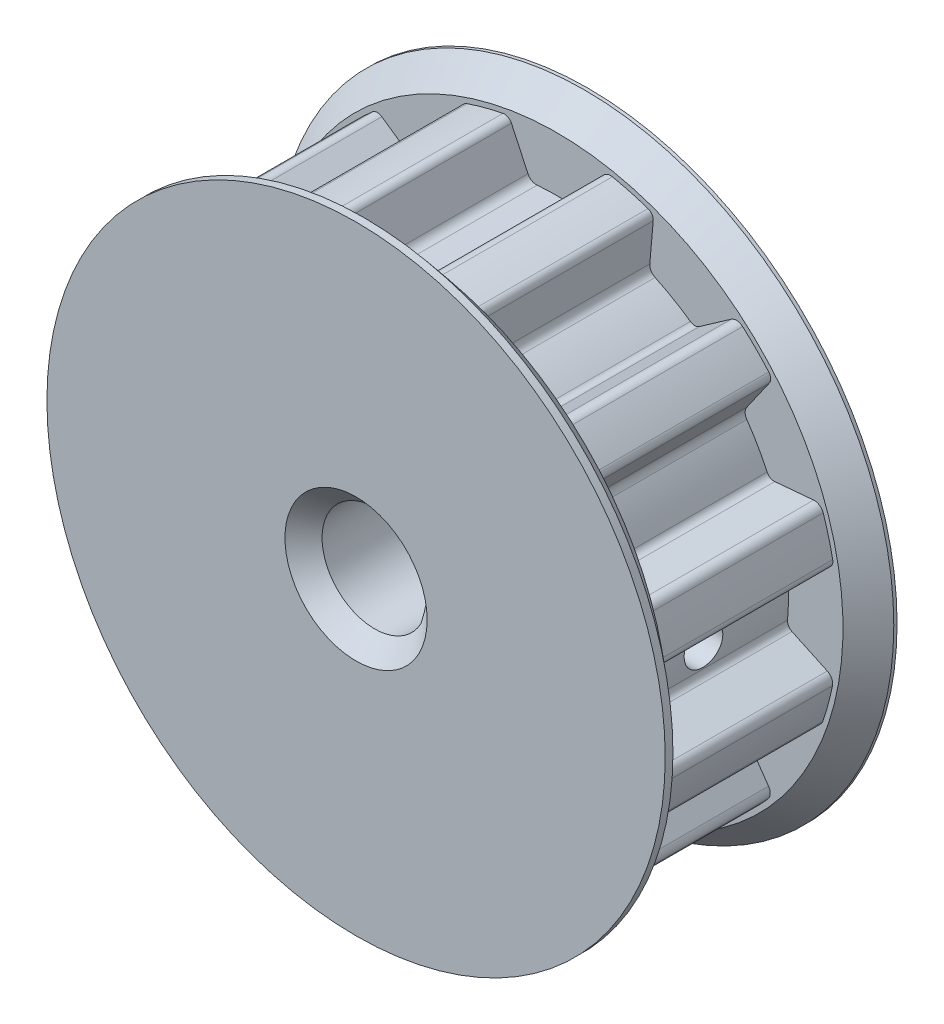
from build123d import *

# Parameters (mm, degrees)
EXTRUDE_1_DEPTH             = 5.5
SKETCH_2_R                  = 20
EXTRUDE_2_DEPTH             = 2
CHAMFER_1_SIZE              = 1.5
CHAMFER_1_SIZE2             = 1.787630389
CHAMFER_1_OF_MIRROR_1_SIZE2 = 1.5
CHAMFER_1_OF_MIRROR_1_SIZE  = 1.787630389
SKETCH_3_R                  = 3.4
CUT_EXTRUDE_1_DEPTH         = 30
CHAMFER_2_SIZE              = 1.2
EXTRUDE_3_REACH             = 31.262
EXTRUDE_3_DIRECTION_2_REACH = 31.262
SKETCH_6_R                  = 1.25
CUT_EXTRUDE_3_DEPTH         = 33
SKETCH_5_R                  = 1.25
CUT_EXTRUDE_2_DEPTH         = 20


with BuildPart() as part:
    # 스케치1 → 보스-돌출1 (new, symmetric)
    with BuildSketch(Plane.XY):
        with BuildLine():
            Line((12.279067203, 9.260056493), (13.72951471, 11.331510209))
            ThreePointArc((13.72951471, 11.331510209), (13.819231237, 11.644886966), (13.696740348, 11.946963163))
            ThreePointArc((13.696740348, 11.946963163), (12.880233507, 12.823034344), (12.007805037, 13.643432236))
            ThreePointArc((12.007805037, 13.643432236), (11.644638313, 13.792108644), (11.267252957, 13.684521298))
            Line((11.267252957, 13.684521298), (9.202645163, 12.238867358))
            ThreePointArc((9.202645163, 12.238867358), (8.915071795, 12.148443996), (8.627783828, 12.239770064))
            ThreePointArc((8.627783828, 12.239770064), (7.516754209, 12.951796446), (6.347354905, 13.563248531))
            ThreePointArc((6.347354905, 13.563248531), (6.081851507, 13.807041329), (6.003955886, 14.158977765))
            Line((6.003955886, 14.158977765), (6.224353416, 16.678133059))
            ThreePointArc((6.224353416, 16.678133059), (6.145361829, 16.994383555), (5.888243509, 17.194743772))
            ThreePointArc((5.888243509, 17.194743772), (4.743092252, 17.54519025), (3.577348088, 17.81946143))
            ThreePointArc((3.577348088, 17.81946143), (3.188498275, 17.766635614), (2.915466643, 17.484769561))
            Line((2.915466643, 17.484769561), (1.850290815, 15.200492627))
            ThreePointArc((1.850290815, 15.200492627), (1.646456756, 14.978397074), (1.351995179, 14.913843704))
            ThreePointArc((1.351995179, 14.913843704), (0.033801995, 14.974961851), (-1.284653671, 14.919795238))
            ThreePointArc((-1.284653671, 14.919795238), (-1.636482757, 14.998174295), (-1.879910562, 15.26401238))
            Line((-1.879910562, 15.26401238), (-2.948618349, 17.555863625))
            ThreePointArc((-2.948618349, 17.555863625), (-3.175152318, 17.790248795), (-3.498003423, 17.835206672))
            ThreePointArc((-3.498003423, 17.835206672), (-4.664956742, 17.566126596), (-5.811656393, 17.220780324))
            ThreePointArc((-5.811656393, 17.220780324), (-6.121997301, 16.980606919), (-6.217516604, 16.599987941))
            Line((-6.217516604, 16.599987941), (-5.997847464, 14.089158172))
            ThreePointArc((-5.997847464, 14.089158172), (-6.06332522, 13.794900649), (-6.286059898, 13.591765005))
            ThreePointArc((-6.286059898, 13.591765005), (-7.458207642, 12.985598321), (-8.572440333, 12.27859486))
            ThreePointArc((-8.572440333, 12.27859486), (-8.916322788, 12.170558572), (-9.260056493, 12.279067203))
            Line((-9.260056493, 12.279067203), (-11.331510209, 13.72951471))
            ThreePointArc((-11.331510209, 13.72951471), (-11.644886966, 13.819231237), (-11.946963163, 13.696740348))
            ThreePointArc((-11.946963163, 13.696740348), (-12.823034344, 12.880233507), (-13.643432236, 12.007805037))
            ThreePointArc((-13.643432236, 12.007805037), (-13.792108644, 11.644638313), (-13.684521298, 11.267252957))
            Line((-13.684521298, 11.267252957), (-12.238867358, 9.202645163))
            ThreePointArc((-12.238867358, 9.202645163), (-12.148443996, 8.915071795), (-12.239770064, 8.627783828))
            ThreePointArc((-12.239770064, 8.627783828), (-12.951796446, 7.516754209), (-13.563248531, 6.347354905))
            ThreePointArc((-13.563248531, 6.347354905), (-13.807041329, 6.081851507), (-14.158977765, 6.003955886))
            Line((-14.158977765, 6.003955886), (-16.678133059, 6.224353416))
            ThreePointArc((-16.678133059, 6.224353416), (-16.994383555, 6.145361829), (-17.194743772, 5.888243509))
            ThreePointArc((-17.194743772, 5.888243509), (-17.54519025, 4.743092252), (-17.81946143, 3.577348088))
            ThreePointArc((-17.81946143, 3.577348088), (-17.766635614, 3.188498275), (-17.484769561, 2.915466643))
            Line((-17.484769561, 2.915466643), (-15.200492627, 1.850290815))
            ThreePointArc((-15.200492627, 1.850290815), (-14.978397015, 1.646456653), (-14.913843726, 1.351994942))
            ThreePointArc((-14.913843726, 1.351994942), (-14.974961851, 0.033801876), (-14.919795238, -1.284653671))
            ThreePointArc((-14.919795238, -1.284653671), (-14.998174295, -1.636482757), (-15.26401238, -1.879910562))
            Line((-15.26401238, -1.879910562), (-17.555863625, -2.948618349))
            ThreePointArc((-17.555863625, -2.948618349), (-17.790248795, -3.175152318), (-17.835206672, -3.498003423))
            ThreePointArc((-17.835206672, -3.498003423), (-17.566126596, -4.664956742), (-17.220780324, -5.811656393))
            ThreePointArc((-17.220780324, -5.811656393), (-16.980606919, -6.121997301), (-16.599987941, -6.217516604))
            Line((-16.599987941, -6.217516604), (-14.089158172, -5.997847464))
            ThreePointArc((-14.089158172, -5.997847464), (-13.794900649, -6.06332522), (-13.591765005, -6.286059898))
            ThreePointArc((-13.591765005, -6.286059898), (-12.985598321, -7.458207642), (-12.27859486, -8.572440333))
            ThreePointArc((-12.27859486, -8.572440333), (-12.170558572, -8.916322788), (-12.279067203, -9.260056493))
            Line((-12.279067203, -9.260056493), (-13.72951471, -11.331510209))
            ThreePointArc((-13.72951471, -11.331510209), (-13.819231237, -11.644886966), (-13.696740348, -11.946963163))
            ThreePointArc((-13.696740348, -11.946963163), (-12.880233507, -12.823034344), (-12.007805037, -13.643432236))
            ThreePointArc((-12.007805037, -13.643432236), (-11.644638313, -13.792108644), (-11.267252957, -13.684521298))
            Line((-11.267252957, -13.684521298), (-9.202645163, -12.238867358))
            ThreePointArc((-9.202645163, -12.238867358), (-8.915071795, -12.148443996), (-8.627783828, -12.239770064))
            ThreePointArc((-8.627783828, -12.239770064), (-7.516754209, -12.951796446), (-6.347354905, -13.563248531))
            ThreePointArc((-6.347354905, -13.563248531), (-6.081851507, -13.807041329), (-6.003955886, -14.158977765))
            Line((-6.003955886, -14.158977765), (-6.224353416, -16.678133059))
            ThreePointArc((-6.224353416, -16.678133059), (-6.145361829, -16.994383555), (-5.888243509, -17.194743772))
            ThreePointArc((-5.888243509, -17.194743772), (-4.743092252, -17.54519025), (-3.577348088, -17.81946143))
            ThreePointArc((-3.577348088, -17.81946143), (-3.188498275, -17.766635614), (-2.915466643, -17.484769561))
            Line((-2.915466643, -17.484769561), (-1.850290815, -15.200492627))
            ThreePointArc((-1.850290815, -15.200492627), (-1.646456653, -14.978397015), (-1.351994942, -14.913843726))
            ThreePointArc((-1.351994942, -14.913843726), (-0.033801876, -14.974961851), (1.284653671, -14.919795238))
            ThreePointArc((1.284653671, -14.919795238), (1.636482757, -14.998174295), (1.879910562, -15.26401238))
            Line((1.879910562, -15.26401238), (2.948618349, -17.555863625))
            ThreePointArc((2.948618349, -17.555863625), (3.175152318, -17.790248795), (3.498003423, -17.835206672))
            ThreePointArc((3.498003423, -17.835206672), (4.664956742, -17.566126596), (5.811656393, -17.220780324))
            ThreePointArc((5.811656393, -17.220780324), (6.121997301, -16.980606919), (6.217516604, -16.599987941))
            Line((6.217516604, -16.599987941), (5.997847464, -14.089158172))
            ThreePointArc((5.997847464, -14.089158172), (6.06332522, -13.794900649), (6.286059898, -13.591765005))
            ThreePointArc((6.286059898, -13.591765005), (7.458207642, -12.985598321), (8.572440333, -12.27859486))
            ThreePointArc((8.572440333, -12.27859486), (8.916322788, -12.170558572), (9.260056493, -12.279067203))
            Line((9.260056493, -12.279067203), (11.331510209, -13.72951471))
            ThreePointArc((11.331510209, -13.72951471), (11.644886966, -13.819231237), (11.946963163, -13.696740348))
            ThreePointArc((11.946963163, -13.696740348), (12.823034344, -12.880233507), (13.643432236, -12.007805037))
            ThreePointArc((13.643432236, -12.007805037), (13.792108644, -11.644638313), (13.684521298, -11.267252957))
            Line((13.684521298, -11.267252957), (12.238867358, -9.202645163))
            ThreePointArc((12.238867358, -9.202645163), (12.148443996, -8.915071914), (12.239769926, -8.627784023))
            ThreePointArc((12.239769926, -8.627784023), (12.951796386, -7.516754312), (13.563248531, -6.347354905))
            ThreePointArc((13.563248531, -6.347354905), (13.807041329, -6.081851507), (14.158977765, -6.003955886))
            Line((14.158977765, -6.003955886), (16.678133059, -6.224353416))
            ThreePointArc((16.678133059, -6.224353416), (16.994383555, -6.145361829), (17.194743772, -5.888243509))
            ThreePointArc((17.194743772, -5.888243509), (17.54519025, -4.743092252), (17.81946143, -3.577348088))
            ThreePointArc((17.81946143, -3.577348088), (17.766635614, -3.188498275), (17.484769561, -2.915466643))
            Line((17.484769561, -2.915466643), (15.200492627, -1.850290815))
            ThreePointArc((15.200492627, -1.850290815), (14.978397015, -1.646456653), (14.913843726, -1.351994942))
            ThreePointArc((14.913843726, -1.351994942), (14.974961851, -0.033801876), (14.919795238, 1.284653671))
            ThreePointArc((14.919795238, 1.284653671), (14.998174295, 1.636482757), (15.26401238, 1.879910562))
            Line((15.26401238, 1.879910562), (17.555863625, 2.948618349))
            ThreePointArc((17.555863625, 2.948618349), (17.790248795, 3.175152318), (17.835206672, 3.498003423))
            ThreePointArc((17.835206672, 3.498003423), (17.566126596, 4.664956742), (17.220780324, 5.811656393))
            ThreePointArc((17.220780324, 5.811656393), (16.980606919, 6.121997301), (16.599987941, 6.217516604))
            Line((16.599987941, 6.217516604), (14.089158172, 5.997847464))
            ThreePointArc((14.089158172, 5.997847464), (13.794900649, 6.06332522), (13.591765005, 6.286059898))
            ThreePointArc((13.591765005, 6.286059898), (12.985598253, 7.458207762), (12.278594702, 8.572440559))
            ThreePointArc((12.278594702, 8.572440559), (12.170558572, 8.916322926), (12.279067203, 9.260056493))
        make_face()
    extrude(amount=EXTRUDE_1_DEPTH, both=True)

    # 스케치2 → 보스-돌출2 (add)
    with BuildSketch(Plane.XY.offset(5.5)):
        Circle(SKETCH_2_R)
    extrude_2 = extrude(amount=EXTRUDE_2_DEPTH)

    # 모따기1
    chamfer_1_edges = [part.edges().sort_by_distance(p)[0] for p in [
        (-20, 0, 5.5),
    ]]
    chamfer_1_side = [part.faces().sort_by_distance(p)[0] for p in [
        (-20, 0, 6.5),
    ]]
    chamfer(chamfer_1_edges, length=CHAMFER_1_SIZE, length2=CHAMFER_1_SIZE2, reference=chamfer_1_side[0])

    # 대칭 복사1: 보스-돌출2 across plane
    add(extrude_2.mirror(Plane.XY))

    # 모따기1 of 대칭 복사1
    chamfer_1_of_mirror_1_edges = [part.edges().sort_by_distance(p)[0] for p in [
        (-20, 0, -5.5),
    ]]
    chamfer(chamfer_1_of_mirror_1_edges, length=CHAMFER_1_OF_MIRROR_1_SIZE, length2=CHAMFER_1_OF_MIRROR_1_SIZE2)

    # 스케치3 → 컷-돌출1 (cut)
    with BuildSketch(Plane(origin=(0, 0, -7.5), x_dir=(-1, 0, 0), z_dir=(0, 0, -1))):
        Circle(SKETCH_3_R)
    extrude(amount=-CUT_EXTRUDE_1_DEPTH, mode=Mode.SUBTRACT)

    # 모따기2
    chamfer_2_edges = [part.edges().sort_by_distance(p)[0] for p in [
        (3.4, 0, 7.5),
        (3.4, 0, -7.5),
    ]]
    chamfer(chamfer_2_edges, length=CHAMFER_2_SIZE)

    # 보스-돌출3: up to this cone (the profile starts outside it)
    extrude_3_end = Plane(origin=(0, 0, 0), z_dir=(0, 0, 1)).offset(2.900001) * Cone(1e-06, 28.862, 28.861999, align=(Align.CENTER, Align.CENTER, Align.MIN), mode=Mode.PRIVATE)
    # 스케치4 → 보스-돌출3 (add, up to the surface)
    with BuildSketch(Plane.XY, mode=Mode.PRIVATE) as extrude_3_sk1:
        with BuildLine():
            ThreePointArc((3.4, 0), (3.2984845, 0.824621125), (3, 1.6))
            Line((3, 1.6), (3, -1.6))
            ThreePointArc((3, -1.6), (3.2984845, -0.824621125), (3.4, 0))
        make_face()
    extrude_3_tool1 = extrude(extrude_3_sk1.sketch, amount=EXTRUDE_3_REACH, mode=Mode.PRIVATE) - extrude_3_end
    add(extrude_3_tool1.solids().sort_by_distance((3.160835, 0, 0))[0])

    # 보스-돌출3 direction 2: up to this cone (the profile starts outside it)
    extrude_3_direction_2_end = Plane(origin=(0, 0, 0), z_dir=(0, 0, -1)).offset(2.900001) * Cone(1e-06, 28.862, 28.861999, align=(Align.CENTER, Align.CENTER, Align.MIN), mode=Mode.PRIVATE)
    # 스케치4 → 보스-돌출3 direction 2 (add, up to the surface)
    with BuildSketch(Plane.XY, mode=Mode.PRIVATE) as extrude_3_direction_2_sk1:
        with BuildLine():
            ThreePointArc((3.4, 0), (3.2984845, 0.824621125), (3, 1.6))
            Line((3, 1.6), (3, -1.6))
            ThreePointArc((3, -1.6), (3.2984845, -0.824621125), (3.4, 0))
        make_face()
    extrude_3_direction_2_tool1 = extrude(extrude_3_direction_2_sk1.sketch, amount=-EXTRUDE_3_DIRECTION_2_REACH, mode=Mode.PRIVATE) - extrude_3_direction_2_end
    add(extrude_3_direction_2_tool1.solids().sort_by_distance((3.160835, 0, 0))[0])

    # 스케치6 → 컷-돌출3 (cut)
    with BuildSketch(Plane(origin=(0, 0, 0), x_dir=(0, 0, -1), z_dir=(1, 0, 0))):
        with Locations(Location((0, 0, 0), (0, 0, 180))):
            Circle(SKETCH_6_R)
    extrude(amount=CUT_EXTRUDE_3_DEPTH, mode=Mode.SUBTRACT)

    # 스케치5 → 컷-돌출2 (cut)
    with BuildSketch(Plane.ZY.offset(-3)):
        Circle(SKETCH_5_R)
    extrude(amount=-CUT_EXTRUDE_2_DEPTH, mode=Mode.SUBTRACT)


solid = part.part
